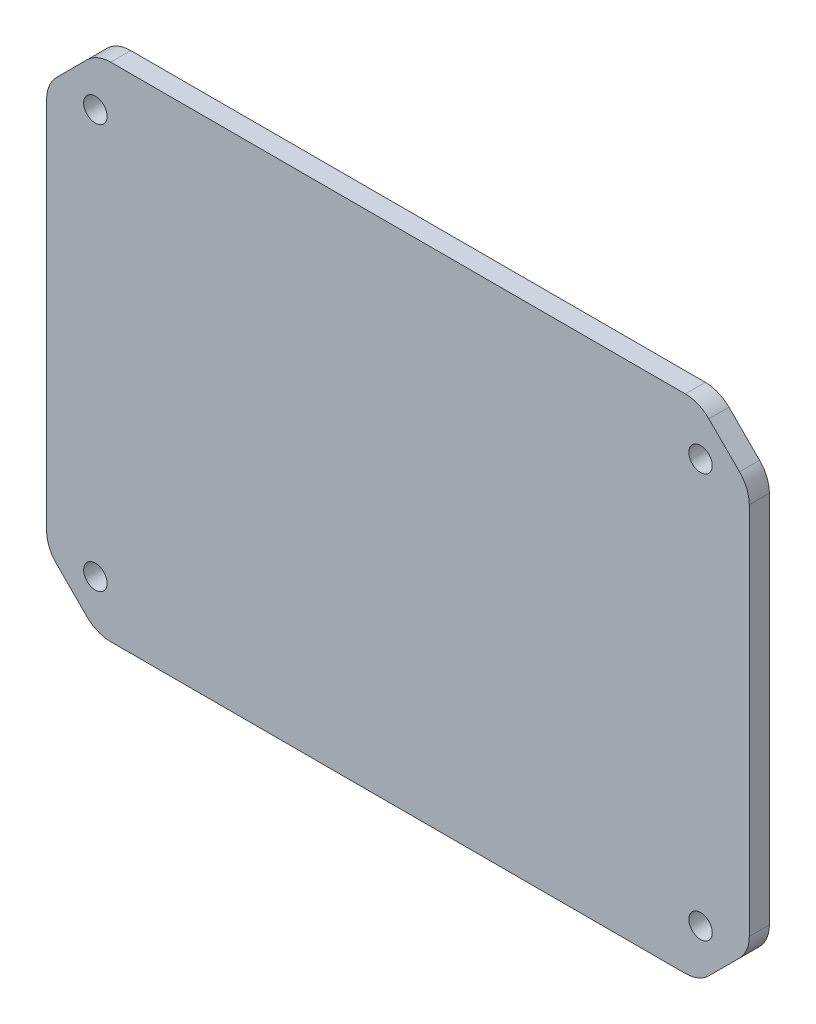
from build123d import *

# Parameters (mm, degrees)
SKETCH_1_R      = 1.75
EXTRUDE_1_DEPTH = 3


with BuildPart() as part:
    # Эскиз1 → Бобышка-Вытянуть1 (new body)
    with BuildSketch(Plane.XY):
        with BuildLine():
            Line((-51.035533906, 31.464466094), (-46.464466094, 36.035533906))
            ThreePointArc((-46.464466094, 36.035533906), (-44.84234935, 37.119397663), (-42.928932188, 37.5))
            Line((-42.928932188, 37.5), (42.928932188, 37.5))
            ThreePointArc((42.928932188, 37.5), (44.84234935, 37.119397663), (46.464466094, 36.035533906))
            Line((46.464466094, 36.035533906), (51.035533906, 31.464466094))
            ThreePointArc((51.035533906, 31.464466094), (52.119397663, 29.84234935), (52.5, 27.928932188))
            Line((52.5, 27.928932188), (52.5, -27.928932188))
            ThreePointArc((52.5, -27.928932188), (52.119397663, -29.84234935), (51.035533906, -31.464466094))
            Line((51.035533906, -31.464466094), (46.464466094, -36.035533906))
            ThreePointArc((46.464466094, -36.035533906), (44.84234935, -37.119397663), (42.928932188, -37.5))
            Line((42.928932188, -37.5), (-42.928932188, -37.5))
            ThreePointArc((-42.928932188, -37.5), (-44.84234935, -37.119397663), (-46.464466094, -36.035533906))
            Line((-46.464466094, -36.035533906), (-51.035533906, -31.464466094))
            ThreePointArc((-51.035533906, -31.464466094), (-52.119397663, -29.84234935), (-52.5, -27.928932188))
            Line((-52.5, -27.928932188), (-52.5, 27.928932188))
            ThreePointArc((-52.5, 27.928932188), (-52.119397663, 29.84234935), (-51.035533906, 31.464466094))
        make_face()
        with Locations((-45.214466094, 30.214466094)):
            Circle(SKETCH_1_R, mode=Mode.SUBTRACT)
        with Locations(Location((-45.214466094, -30.214466094, 0), (0, 0, 180))):
            Circle(SKETCH_1_R, mode=Mode.SUBTRACT)
        with Locations((45.214466094, -30.214466094)):
            Circle(SKETCH_1_R, mode=Mode.SUBTRACT)
        with Locations(Location((45.214466094, 30.214466094, 0), (0, 0, 180))):
            Circle(SKETCH_1_R, mode=Mode.SUBTRACT)
    extrude(amount=EXTRUDE_1_DEPTH)


solid = part.part
